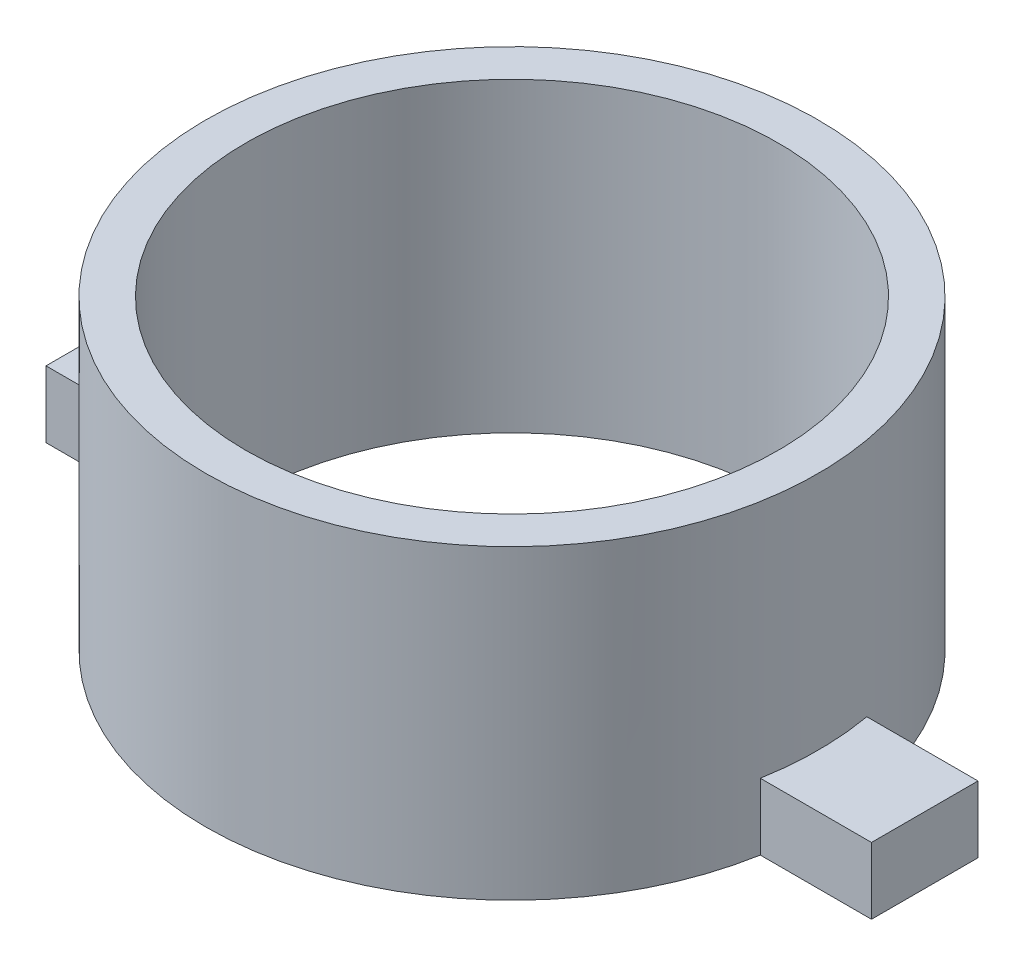
from build123d import *

# Parameters (mm, degrees)
SKETCH_1_R      = 23
SKETCH_1_R_2    = 20
EXTRUDE_1_DEPTH = 23
SKETCH_3_W      = 9
SKETCH_3_H      = 5
EXTRUDE_2_DEPTH = 4


with BuildPart() as part:
    # 草图1 → 凸台-拉伸1 (new body)
    with BuildSketch(Plane(origin=(0, 0, 0), x_dir=(1, 0, 0), z_dir=(0, 1, 0))):
        with Locations(Location((0, 0, 0), (0, 0, 270))):
            Circle(SKETCH_1_R)
        with Locations(Location((0, 0, 0), (0, 0, 270))):
            Circle(SKETCH_1_R_2, mode=Mode.SUBTRACT)
    extrude(amount=EXTRUDE_1_DEPTH)

    # 草图3 → 凸台-拉伸2 (add, symmetric)
    with BuildSketch(Plane.XY):
        with Locations((-26.5, 2.5)):
            Rectangle(SKETCH_3_W, SKETCH_3_H)
    extrude_2 = extrude(amount=EXTRUDE_2_DEPTH, both=True)

    # 镜向1: 凸台-拉伸2 across plane
    add(extrude_2.mirror(Plane(origin=(0, 0, 0), x_dir=(0, 0, 1), z_dir=(1, 0, 0))))


solid = part.part
